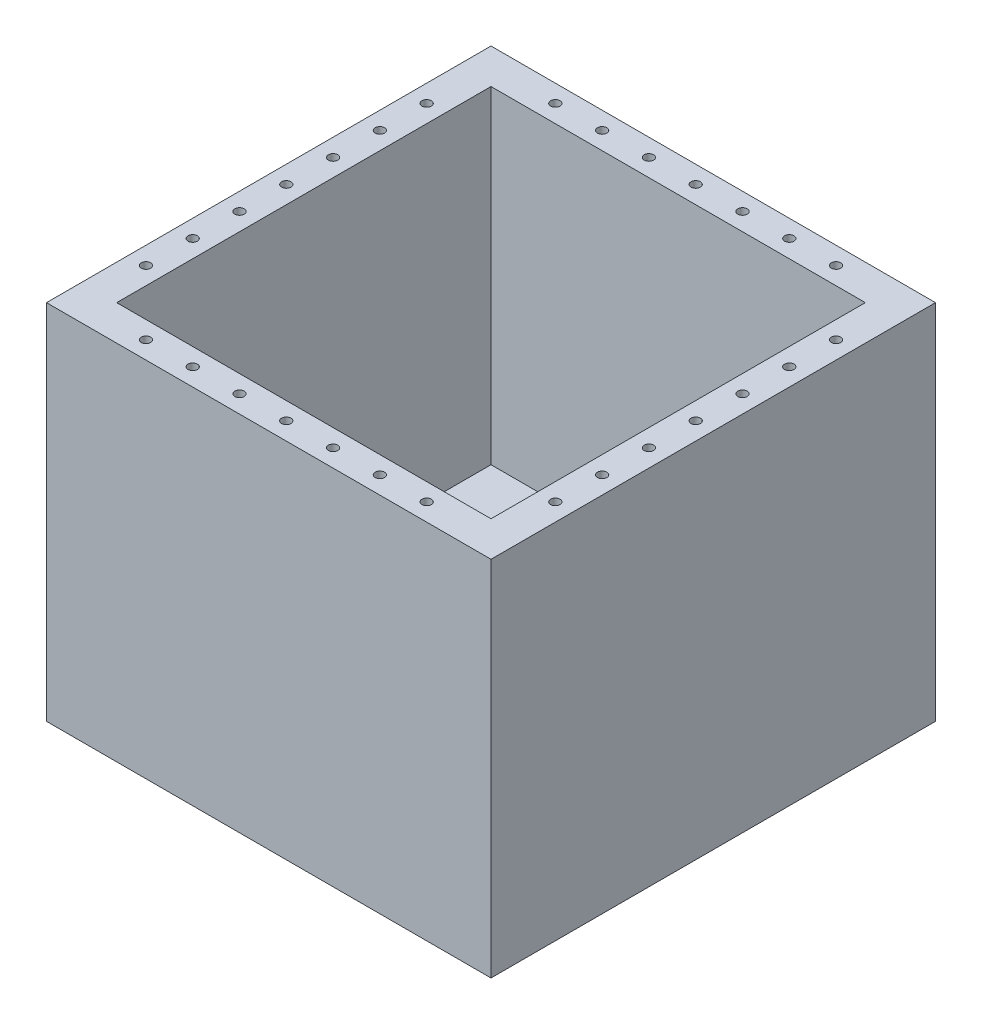
from build123d import *

# Parameters (mm, degrees)
SKETCH1_W                   = 241.3
SKETCH1_H                   = 241.3
SKETCH1_W_2                 = 203.2
SKETCH1_H_2                 = 203.2
EXTRUDE_THIN1_DEPTH         = 177.8
SKETCH2_W                   = 241.3
SKETCH2_H                   = 241.3
BOSS_EXTRUDE1_DEPTH         = 19.05
F_1_4_20_TAPPED_HOLE1_D     = 5.1054
F_1_4_20_TAPPED_HOLE1_DEPTH = 16.51
F_1_4_20_TAPPED_HOLE1_TIP   = 1.533816902


with BuildPart() as part:
    # Sketch1 → Extrude-Thin1 (new body)
    with BuildSketch(Plane(origin=(0, 0, 0), x_dir=(1, 0, 0), z_dir=(0, 1, 0))):
        Rectangle(SKETCH1_W, SKETCH1_H)
        Rectangle(SKETCH1_W_2, SKETCH1_H_2, mode=Mode.SUBTRACT)
    extrude(amount=EXTRUDE_THIN1_DEPTH)

    # Sketch2 → Boss-Extrude1 (add)
    with BuildSketch(Plane(origin=(0, 0, 0), x_dir=(1, 0, 0), z_dir=(0, 1, 0))):
        Rectangle(SKETCH2_W, SKETCH2_H)
    extrude(amount=-BOSS_EXTRUDE1_DEPTH)

    # 1/4-20 Tapped Hole1
    with Locations(Plane(origin=(0, 177.8, 0), x_dir=(1, 0, 0), z_dir=(0, 1, 0))):
        with Locations((-76.2, -111.125), (-111.125, 76.2), (-111.125, 50.8), (-111.125, 25.4), (-111.125, 0), (-111.125, -25.4), (-111.125, -50.8), (-111.125, -76.2), (111.125, -76.2), (111.125, -50.8), (111.125, -25.4), (111.125, 0), (111.125, 25.4), (111.125, 50.8), (111.125, 76.2), (-76.2, 111.125), (-50.8, 111.125), (-25.4, 111.125), (0, 111.125), (25.4, 111.125), (50.8, 111.125), (76.2, 111.125), (76.2, -111.125), (50.8, -111.125), (25.4, -111.125), (0, -111.125), (-25.4, -111.125), (-50.8, -111.125)):
            Hole(F_1_4_20_TAPPED_HOLE1_D / 2, depth=F_1_4_20_TAPPED_HOLE1_DEPTH)
            with Locations((0, 0, -(F_1_4_20_TAPPED_HOLE1_DEPTH + F_1_4_20_TAPPED_HOLE1_TIP / 2))):  # 118° drill point
                Cone(0, F_1_4_20_TAPPED_HOLE1_D / 2, F_1_4_20_TAPPED_HOLE1_TIP, mode=Mode.SUBTRACT)


solid = part.part
